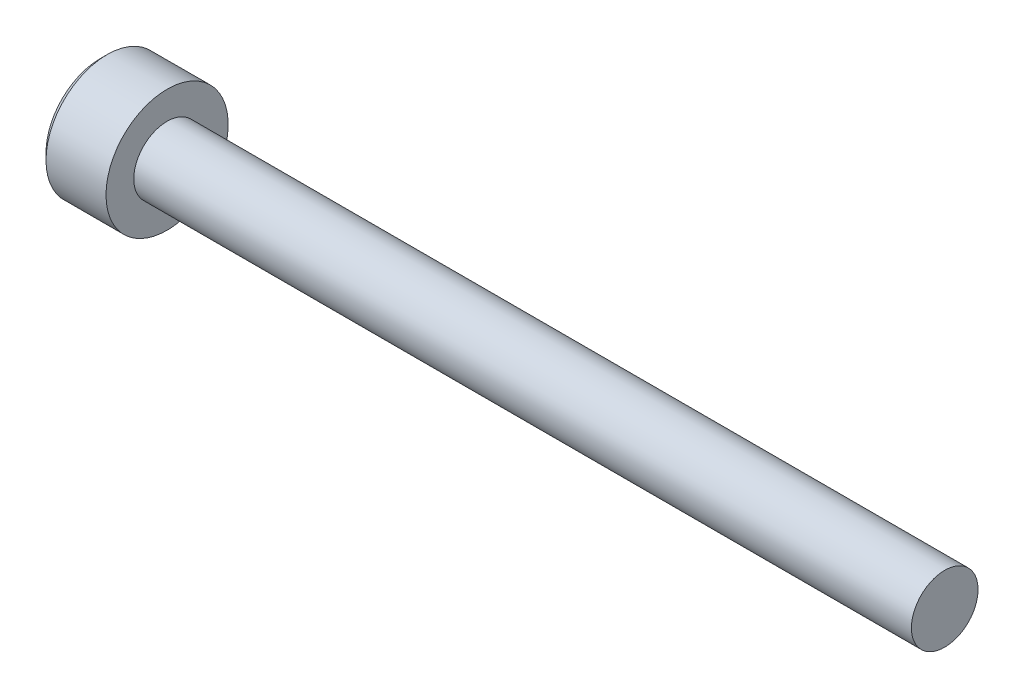
from build123d import *

# Parameters (mm, degrees)
CUT_EXTRUDE1_DEPTH = 1.3
CHAMFER1_SIZE      = 0.3


with BuildPart() as part:
    # Sketch1 → Revolve1 (revolve)
    with BuildSketch(Plane.XY, mode=Mode.PRIVATE) as revolve1_sk:
        Polygon((-3, 0), (35, 0), (35, 1.5), (0, 1.5), (0, 2.75), (-3, 2.75), align=None)
    revolve(revolve1_sk.sketch.rotate(Axis((-3, 0, 0), (1, 0, 0)), 90), axis=Axis((-3, 0, 0), (1, 0, 0)))

    # Sketch2 → Cut-Extrude1 (cut)
    with BuildSketch(Plane.ZY.offset(3)):
        Polygon((0, 1.443375673), (-1.25, 0.721687836), (-1.25, -0.721687836), (0, -1.443375673), (1.25, -0.721687836), (1.25, 0.721687836), align=None)
    extrude(amount=-CUT_EXTRUDE1_DEPTH, mode=Mode.SUBTRACT)

    # Sketch6 → Cut-Revolve1 (revolve, cut)
    with BuildSketch(Plane.XY, mode=Mode.PRIVATE) as cut_revolve1_sk:
        Polygon((-1.7, 0), (-1.7, 1.25), (-0.978312164, 0), align=None)
    revolve(cut_revolve1_sk.sketch.rotate(Axis((-1.7, 0, 0), (-1, 0, 0)), 180), axis=Axis((-1.7, 0, 0), (-1, 0, 0)), mode=Mode.SUBTRACT)

    # Chamfer1
    chamfer1_edges = [part.edges().sort_by_distance(p)[0] for p in [
        (-3, 0, -2.75),
    ]]
    chamfer(chamfer1_edges, length=CHAMFER1_SIZE)


solid = part.part
